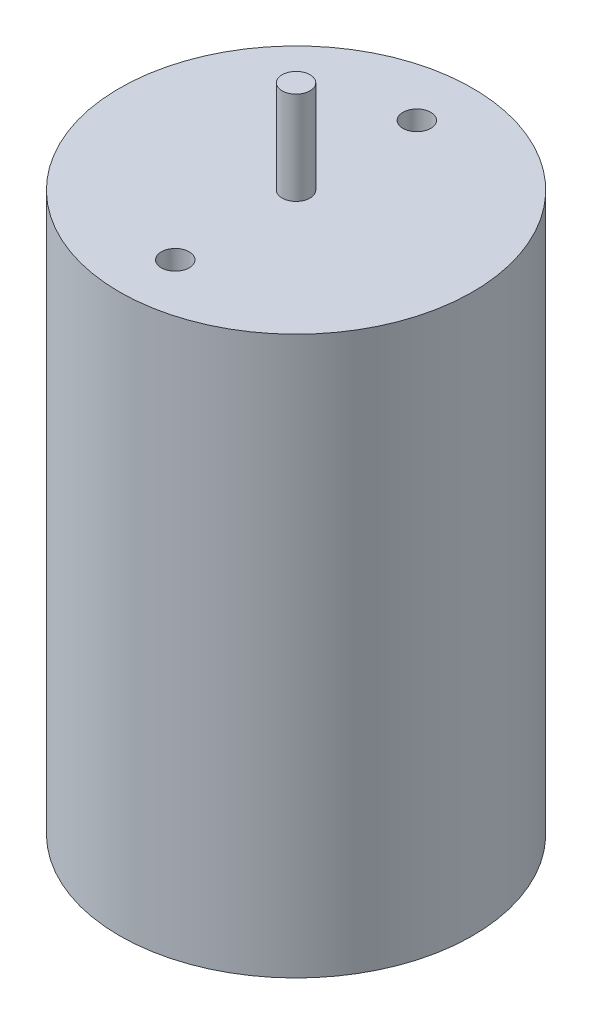
from build123d import *

# Parameters (mm, degrees)
SKETCH1_R           = 19
BOSS_EXTRUDE1_DEPTH = 60
SKETCH2_R           = 1.5
BOSS_EXTRUDE2_DEPTH = 10
SKETCH3_R           = 1.5
CUT_EXTRUDE1_DEPTH  = 10


with BuildPart() as part:
    # Sketch1 → Boss-Extrude1 (new body)
    with BuildSketch(Plane(origin=(0, 0, 0), x_dir=(1, 0, 0), z_dir=(0, 1, 0))):
        with Locations(Location((0, 0, 0), (0, 0, 270))):
            Circle(SKETCH1_R)
    extrude(amount=BOSS_EXTRUDE1_DEPTH)

    # Sketch2 → Boss-Extrude2 (add)
    with BuildSketch(Plane(origin=(0, 60, 0), x_dir=(1, 0, 0), z_dir=(0, 1, 0))):
        with Locations(Location((0, 0, 0), (0, 0, 270))):
            Circle(SKETCH2_R)
    extrude(amount=BOSS_EXTRUDE2_DEPTH)

    # Sketch3 → Cut-Extrude1 (cut)
    with BuildSketch(Plane(origin=(0, 60, 0), x_dir=(1, 0, 0), z_dir=(0, 1, 0))):
        with Locations(Location((0, -13, 0), (0, 0, 270))):
            Circle(SKETCH3_R)
        with Locations(Location((0, 13, 0), (0, 0, 270))):
            Circle(SKETCH3_R)
    extrude(amount=-CUT_EXTRUDE1_DEPTH, mode=Mode.SUBTRACT)


solid = part.part
